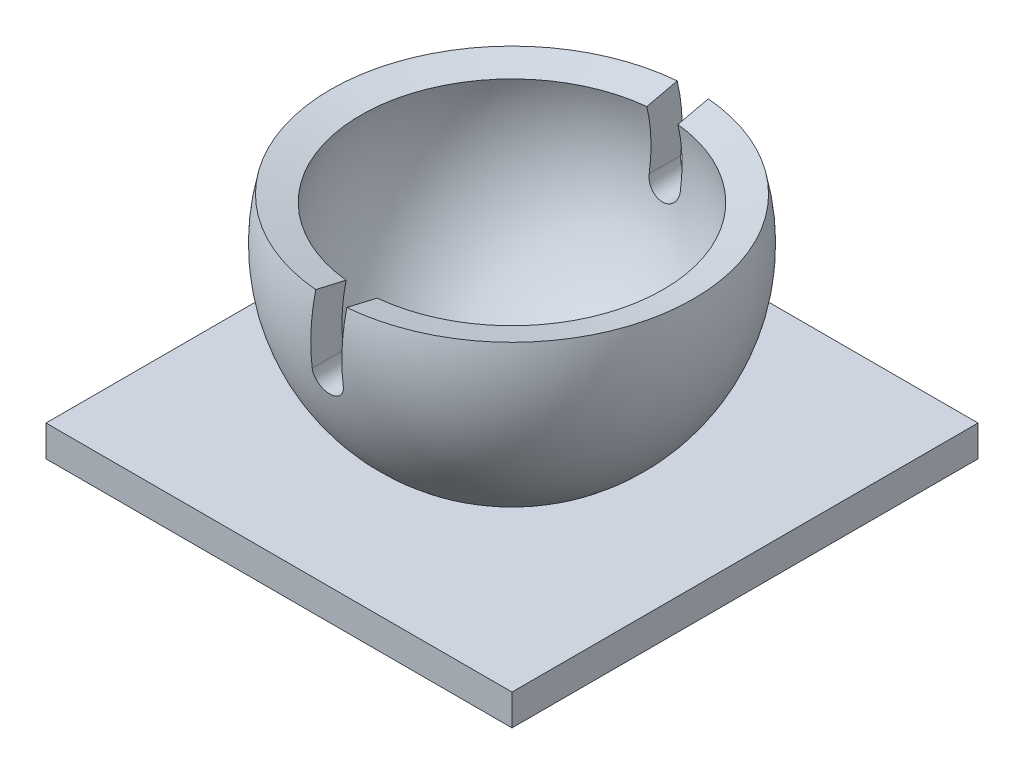
from build123d import *

# Parameters (mm, degrees)
CUT_EXTRUDE1_DEPTH      = 44.589870827
CUT_EXTRUDE1_DEPTH_BACK = 44.589870827
SKETCH4_W               = 60
SKETCH4_H               = 60
BOSS_EXTRUDE1_DEPTH     = 4


with BuildPart() as part:
    # Sketch1 → Revolve1 (revolve)
    with BuildSketch(Plane.XY, mode=Mode.PRIVATE) as revolve1_sk:
        with BuildLine():
            Line((0, -23.350993377), (0, -27.350993377))
            ThreePointArc((0, -27.350993377), (18.81908657, -18.245354078), (23.358188619, 2.1621749))
            Line((23.358188619, 2.1621749), (19.462239628, 1.255657105))
            ThreePointArc((19.462239628, 1.255657105), (15.686507094, -15.757987178), (0, -23.350993377))
        make_face()
    revolve(revolve1_sk.sketch.rotate(Axis((0, 16.649006623, 0), (0, -1, 0)), 180), axis=Axis((0, 16.649006623, 0), (0, -1, 0)))

    # Sketch2 → Cut-Extrude1 (cut, two sides: drawn at the far end of the back side and taken through both)
    with BuildSketch(Plane.XY.offset(-CUT_EXTRUDE1_DEPTH_BACK)):
        with BuildLine():
            Line((0, 13.619569371), (-2, 13.619569371))
            Line((-2, 13.619569371), (-2, -6.380430629))
            ThreePointArc((-2, -6.380430629), (0, -8.380430629), (2, -6.380430629))
            Line((2, -6.380430629), (2, 13.619569371))
            Line((2, 13.619569371), (0, 13.619569371))
        make_face()
    extrude(amount=CUT_EXTRUDE1_DEPTH + CUT_EXTRUDE1_DEPTH_BACK, mode=Mode.SUBTRACT)

    # Sketch4 → Boss-Extrude1 (add)
    with BuildSketch(Plane(origin=(0, -27.350993377, 0), x_dir=(-1, 0, 0), z_dir=(0, -1, 0))):
        Rectangle(SKETCH4_W, SKETCH4_H)
    extrude(amount=-BOSS_EXTRUDE1_DEPTH)


solid = part.part
